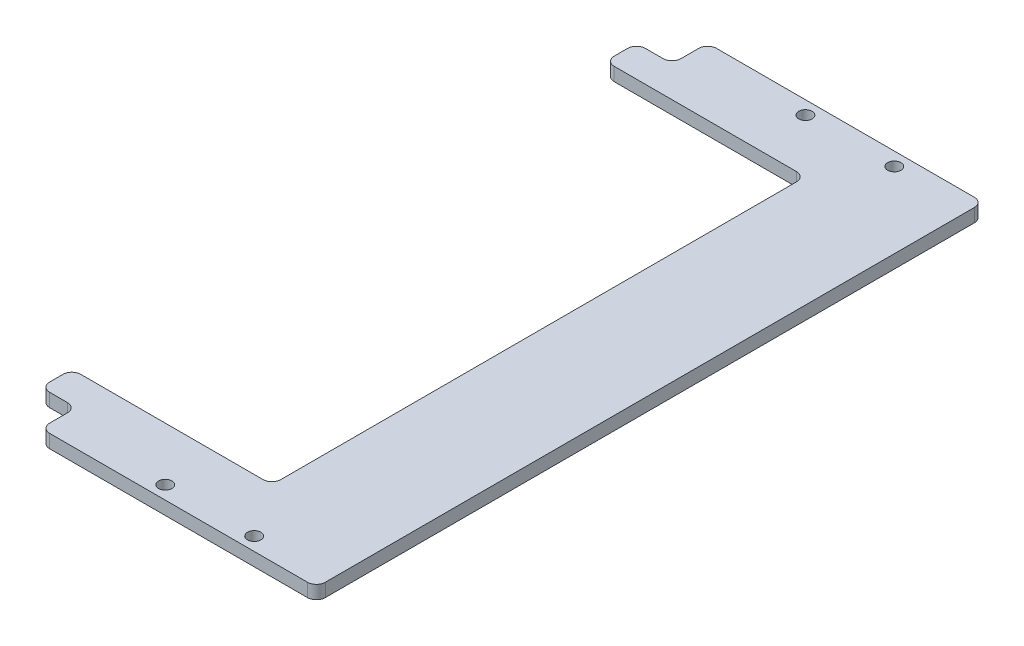
from build123d import *

# Parameters (mm, degrees)
EXTRUDE_1_DEPTH     = 3
SKETCH_2_W          = 8
SKETCH_2_H          = 8
CUT_EXTRUDE_1_DEPTH = 10
SKETCH_3_R          = 1.5
CUT_EXTRUDE_2_DEPTH = 10
FILLET_1_R          = 2


with BuildPart() as part:
    # 草图1 → 凸台-拉伸1 (new body)
    with BuildSketch(Plane(origin=(0, 0, 0), x_dir=(1, 0, 0), z_dir=(0, 1, 0))):
        Polygon((0, 0), (70, 0), (70, 150), (0, 150), (0, 135), (45, 135), (45, 15), (0, 15), align=None)
    extrude(amount=EXTRUDE_1_DEPTH)

    # 草图2 → 切除-拉伸1 (cut)
    with BuildSketch(Plane(origin=(0, 3, 0), x_dir=(1, 0, 0), z_dir=(0, 1, 0))):
        with Locations((4, 4)):
            Rectangle(SKETCH_2_W, SKETCH_2_H)
        with Locations((4, 146)):
            Rectangle(SKETCH_2_W, SKETCH_2_H)
    extrude(amount=-CUT_EXTRUDE_1_DEPTH, mode=Mode.SUBTRACT)

    # 草图3 → 切除-拉伸2 (cut)
    with BuildSketch(Plane(origin=(0, 3, 0), x_dir=(1, 0, 0), z_dir=(0, 1, 0))):
        with Locations(Location((33, 3, 0), (0, 0, 270))):
            Circle(SKETCH_3_R)
        with Locations(Location((53, 3, 0), (0, 0, 270))):
            Circle(SKETCH_3_R)
        with Locations(Location((53, 147, 0), (0, 0, 270))):
            Circle(SKETCH_3_R)
        with Locations(Location((33, 147, 0), (0, 0, 270))):
            Circle(SKETCH_3_R)
    extrude(amount=-CUT_EXTRUDE_2_DEPTH, mode=Mode.SUBTRACT)

    # 圆角1
    fillet_1_edges = [part.edges().sort_by_distance(p)[0] for p in [
        (0, 1.5, -15),
        (45, 1.5, -15),
        (45, 1.5, -135),
        (0, 1.5, -135),
        (70, 1.5, -150),
        (70, 1.5, 0),
        (8, 1.5, 0),
        (0, 1.5, -8),
        (8, 1.5, -8),
        (0, 1.5, -142),
        (8, 1.5, -150),
        (8, 1.5, -142),
    ]]
    fillet(fillet_1_edges, radius=FILLET_1_R)


solid = part.part
